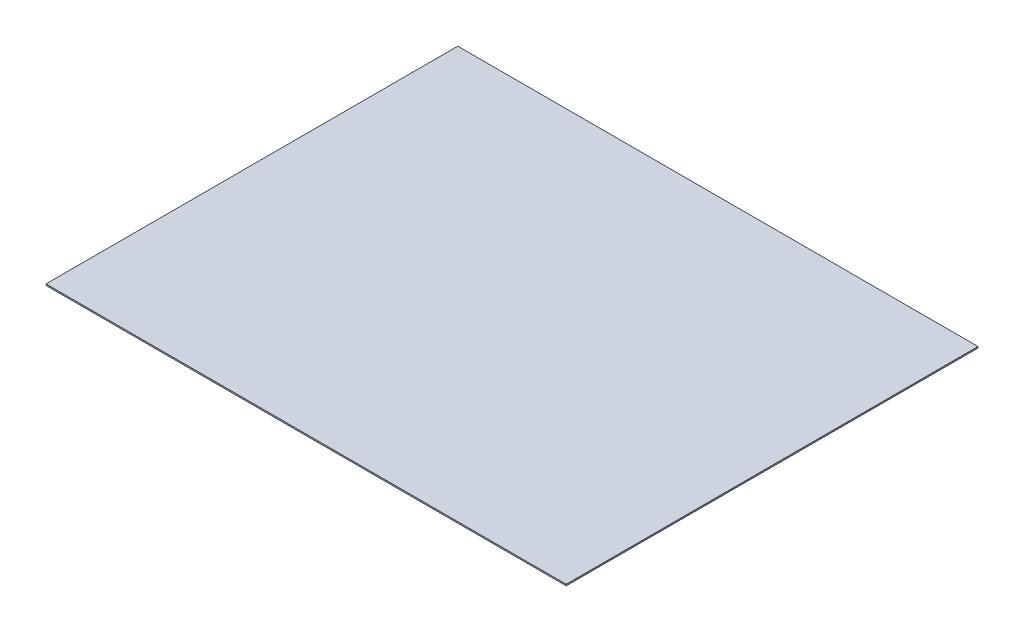
from build123d import *

# Parameters (mm, degrees)
SKETCH_1_W      = 293.708722149
SKETCH_1_H      = 478.372734029
SKETCH_1_W_2    = 400
SKETCH_1_H_2    = 400
SKETCH_1_W_3    = 293.70872215
SKETCH_1_W_4    = 200
EXTRUDE_1_DEPTH = 10


with BuildPart() as part:
    # 草图1 → 凸台-拉伸1 (new body)
    # profile 1 of 11: a face of its own
    with BuildSketch(Plane(origin=(0, 0, 0), x_dir=(1, 0, 0), z_dir=(0, 1, 0))):
        Polygon((0, 616.741078133), (0, 0), (250, 0), (250, 400), (450, 400), (650, 400), (650, 0), (3790, 0), (3790, 3000), (0, 3000), (0, 2295.113812162), (293.70872215, 2295.113812162), (293.70872215, 1816.741078133), (0, 1816.741078133), (0, 1695.113812162), (293.70872215, 1695.113812162), (293.70872215, 1216.741078133), (0, 1216.741078133), (0, 1095.113812162), (293.70872215, 1095.113812162), (293.70872215, 616.741078133), align=None)
        with Locations((545.140209415, 855.927445148)):
            Rectangle(SKETCH_1_W, SKETCH_1_H, mode=Mode.SUBTRACT)
        with Locations((545.140209415, 1455.927445148)):
            Rectangle(SKETCH_1_W, SKETCH_1_H, mode=Mode.SUBTRACT)
        with Locations((2468.227032278, 347.452363292)):
            Rectangle(SKETCH_1_W_2, SKETCH_1_H_2, mode=Mode.SUBTRACT)
        with Locations((2148.614401298, 1319.656146888)):
            Rectangle(SKETCH_1_W_2, SKETCH_1_H_2, mode=Mode.SUBTRACT)
        with Locations((545.140209415, 2055.927445148)):
            Rectangle(SKETCH_1_W, SKETCH_1_H, mode=Mode.SUBTRACT)
    # profile 2 of 11: a face of its own
    with BuildSketch(Plane(origin=(0, 0, 0), x_dir=(1, 0, 0), z_dir=(0, 1, 0))):
        with Locations((146.854361075, 2055.927445148)):
            Rectangle(SKETCH_1_W_3, SKETCH_1_H)
    # profile 3 of 11: a face of its own
    with BuildSketch(Plane(origin=(0, 0, 0), x_dir=(1, 0, 0), z_dir=(0, 1, 0))):
        with Locations((146.854361075, 1455.927445148)):
            Rectangle(SKETCH_1_W_3, SKETCH_1_H)
    # profile 4 of 11: a face of its own
    with BuildSketch(Plane(origin=(0, 0, 0), x_dir=(1, 0, 0), z_dir=(0, 1, 0))):
        with Locations((545.140209415, 2055.927445148)):
            Rectangle(SKETCH_1_W, SKETCH_1_H)
    # profile 5 of 11: a face of its own
    with BuildSketch(Plane(origin=(0, 0, 0), x_dir=(1, 0, 0), z_dir=(0, 1, 0))):
        with Locations((545.140209415, 1455.927445148)):
            Rectangle(SKETCH_1_W, SKETCH_1_H)
    # profile 6 of 11: a face of its own
    with BuildSketch(Plane(origin=(0, 0, 0), x_dir=(1, 0, 0), z_dir=(0, 1, 0))):
        with Locations((146.854361075, 855.927445148)):
            Rectangle(SKETCH_1_W_3, SKETCH_1_H)
    # profile 7 of 11: a face of its own
    with BuildSketch(Plane(origin=(0, 0, 0), x_dir=(1, 0, 0), z_dir=(0, 1, 0))):
        with Locations((545.140209415, 855.927445148)):
            Rectangle(SKETCH_1_W, SKETCH_1_H)
    # profile 8 of 11: a face of its own
    with BuildSketch(Plane(origin=(0, 0, 0), x_dir=(1, 0, 0), z_dir=(0, 1, 0))):
        with Locations((550, 200)):
            Rectangle(SKETCH_1_W_4, SKETCH_1_H_2)
    # profile 9 of 11: a face of its own
    with BuildSketch(Plane(origin=(0, 0, 0), x_dir=(1, 0, 0), z_dir=(0, 1, 0))):
        with Locations((350, 200)):
            Rectangle(SKETCH_1_W_4, SKETCH_1_H_2)
    # profile 10 of 11: a face of its own
    with BuildSketch(Plane(origin=(0, 0, 0), x_dir=(1, 0, 0), z_dir=(0, 1, 0))):
        with Locations((2148.614401298, 1319.656146888)):
            Rectangle(SKETCH_1_W_2, SKETCH_1_H_2)
    # profile 11 of 11: a face of its own
    with BuildSketch(Plane(origin=(0, 0, 0), x_dir=(1, 0, 0), z_dir=(0, 1, 0))):
        with Locations((2468.227032278, 347.452363292)):
            Rectangle(SKETCH_1_W_2, SKETCH_1_H_2)
    extrude(amount=EXTRUDE_1_DEPTH)


solid = part.part
